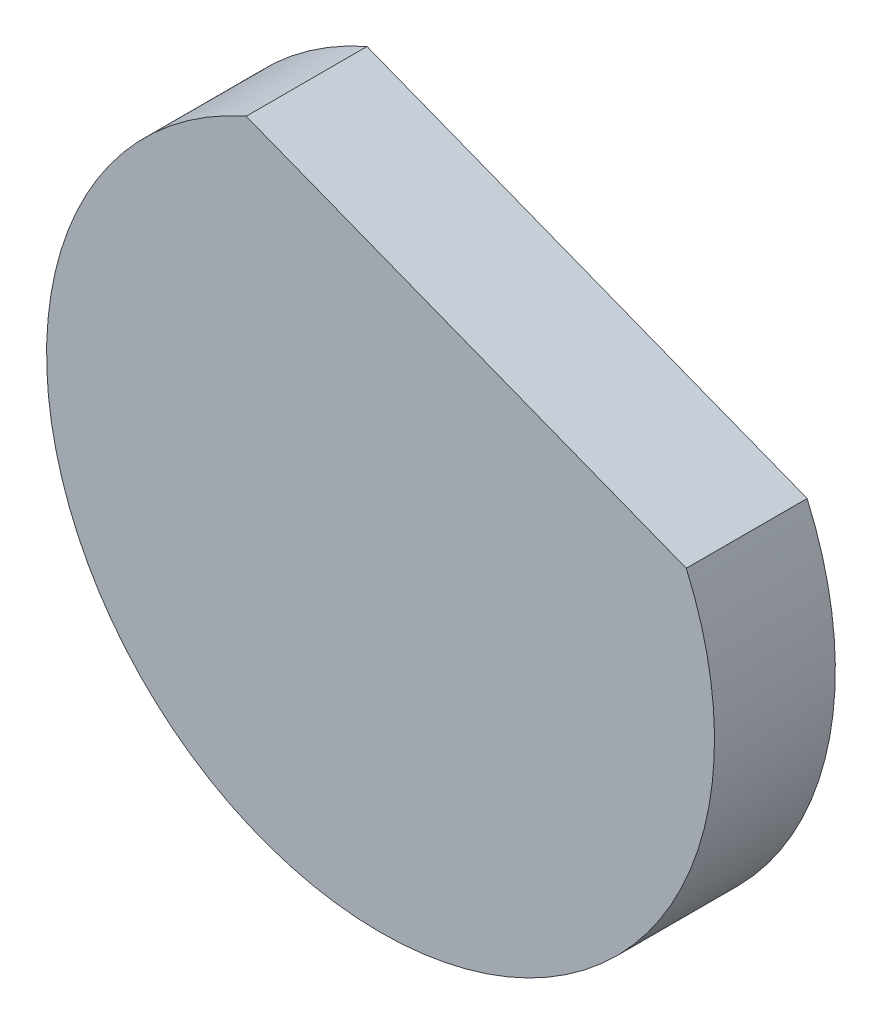
from build123d import *

# Parameters (mm, degrees)
CURVEBOSS_DEPTH = 7.139


with BuildPart() as part:
    # CurveSketch → CurveBoss (new body)
    with BuildSketch(Plane.XY):
        with BuildLine():
            Line((-13.073822369, 31.783307673), (12.927307673, 21.655822369))
            ThreePointArc((12.927307673, 21.655822369), (-12.298213535, -4.666575371), (-13.073822369, 31.783307673))
        make_face()
    extrude(amount=CURVEBOSS_DEPTH)


solid = part.part
